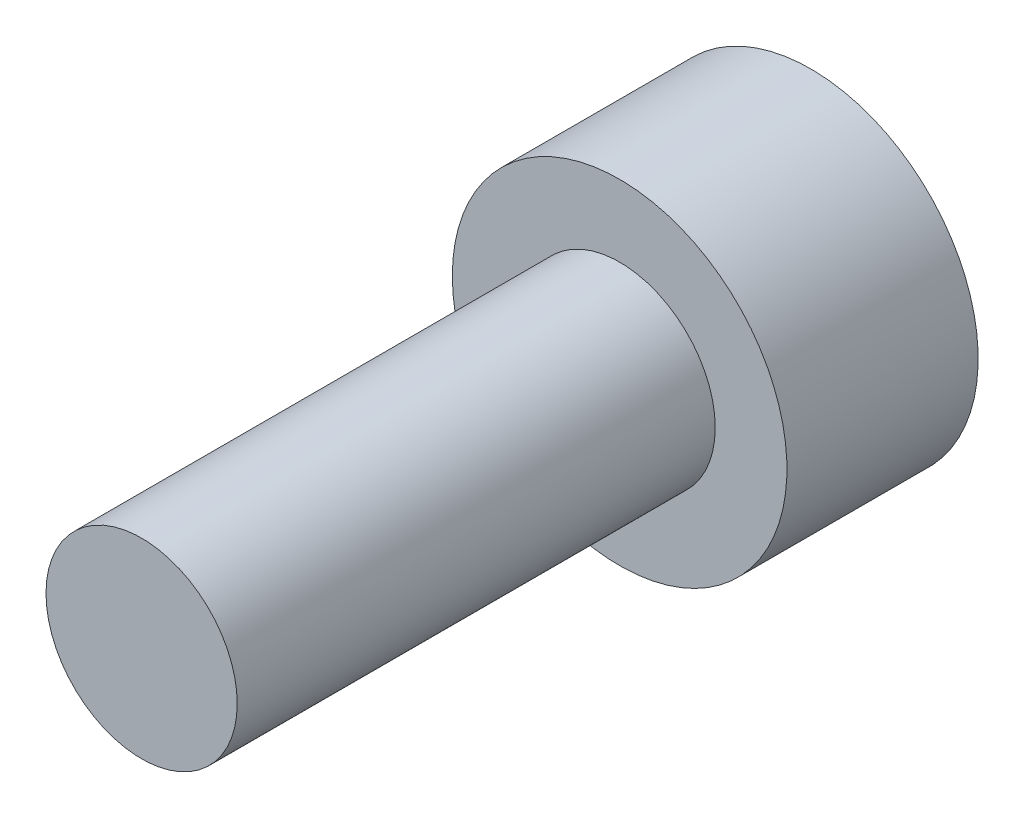
from build123d import *

# Parameters (mm, degrees)
CUT_EXTRUDE_1_DEPTH = 2


with BuildPart() as part:
    # 草图1 → 旋转1 (revolve)
    with BuildSketch(Plane(origin=(0, 0, 0), x_dir=(1, 0, 0), z_dir=(0, 1, 0)), mode=Mode.PRIVATE) as revolve_1_sk:
        Polygon((0, 0), (2, 0), (2, 10), (3.5, 10), (3.5, 14), (0, 14), align=None)
    revolve(revolve_1_sk.sketch.rotate(Axis((0, 0, -14), (0, 0, 1)), 180), axis=Axis((0, 0, -14), (0, 0, 1)))

    # 草图2 → 切除-拉伸1 (cut)
    with BuildSketch(Plane(origin=(0, 0, -14), x_dir=(-1, 0, 0), z_dir=(0, 0, -1))):
        Polygon((0, 2.193931023), (-1.9, 1.096965511), (-1.9, -1.096965511), (0, -2.193931023), (1.9, -1.096965511), (1.9, 1.096965511), align=None)
    extrude(amount=-CUT_EXTRUDE_1_DEPTH, mode=Mode.SUBTRACT)


solid = part.part
